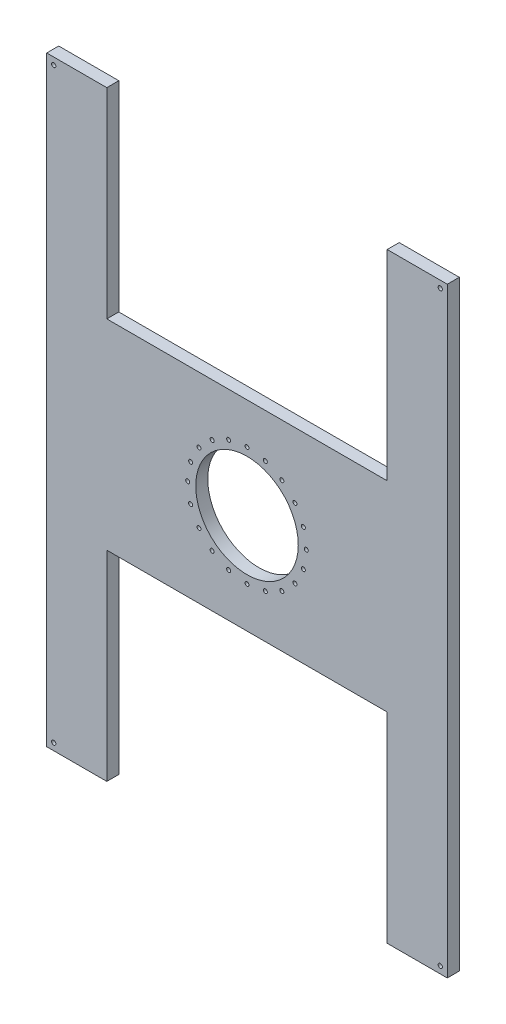
from build123d import *

# Parameters (mm, degrees)
BOSS_EXTRU_1_DEPTH           = 60
ESQUISSE2_R                  = 256
ENL_V_MAT_EXTRU_1_DEPTH      = 2237.872817127
ESQUISSE5_R                  = 10
ENL_V_MAT_EXTRU_3_DEPTH      = 2237.872817127
R_P_TITION_CIRCULAIRE1_COUNT = 20
ESQUISSE6_R                  = 10.5
ENL_V_MAT_EXTRU_4_DEPTH      = 2237.872817127


with BuildPart() as part:
    # Esquisse1 → Boss.-Extru.1 (new body)
    with BuildSketch(Plane.XY):
        Polygon((-1000, 2000), (-700, 2000), (-700, 1000), (700, 1000), (700, 2000), (1000, 2000), (1000, -1000), (700, -1000), (700, 0), (-700, 0), (-700, -1000), (-1000, -1000), align=None)
    extrude(amount=BOSS_EXTRU_1_DEPTH)

    # Esquisse2 → Enlèv. mat.-Extru.1 (cut, through all)
    with BuildSketch(Plane.XY.offset(60)):
        with Locations((0, 500)):
            Circle(ESQUISSE2_R)
    extrude(amount=-ENL_V_MAT_EXTRU_1_DEPTH, mode=Mode.SUBTRACT)

    # Esquisse5 → Enlèv. mat.-Extru.3 (cut, through all)
    with BuildSketch(Plane.XY):
        with Locations((0, 796)):
            Circle(ESQUISSE5_R)
    enl_v_mat_extru_3 = extrude(amount=ENL_V_MAT_EXTRU_3_DEPTH, mode=Mode.SUBTRACT)

    # Répétition circulaire1: Enlèv. mat.-Extru.3 ×20 about axis
    r_p_tition_circulaire1_axis = Axis((0, 500, 0), (0, 0, 1))
    for i in range(1, R_P_TITION_CIRCULAIRE1_COUNT):
        add(enl_v_mat_extru_3.rotate(r_p_tition_circulaire1_axis, i * 360 / R_P_TITION_CIRCULAIRE1_COUNT), mode=Mode.SUBTRACT)

    # Esquisse6 → Enlèv. mat.-Extru.4 (cut, through all)
    with BuildSketch(Plane(origin=(0, 0, 0), x_dir=(-1, 0, 0), z_dir=(0, 0, -1))):
        with Locations((-965, 1965)):
            Circle(ESQUISSE6_R)
        with Locations((-965, -965)):
            Circle(ESQUISSE6_R)
        with Locations((965, -965)):
            Circle(ESQUISSE6_R)
        with Locations((965, 1965)):
            Circle(ESQUISSE6_R)
    extrude(amount=-ENL_V_MAT_EXTRU_4_DEPTH, mode=Mode.SUBTRACT)


solid = part.part
